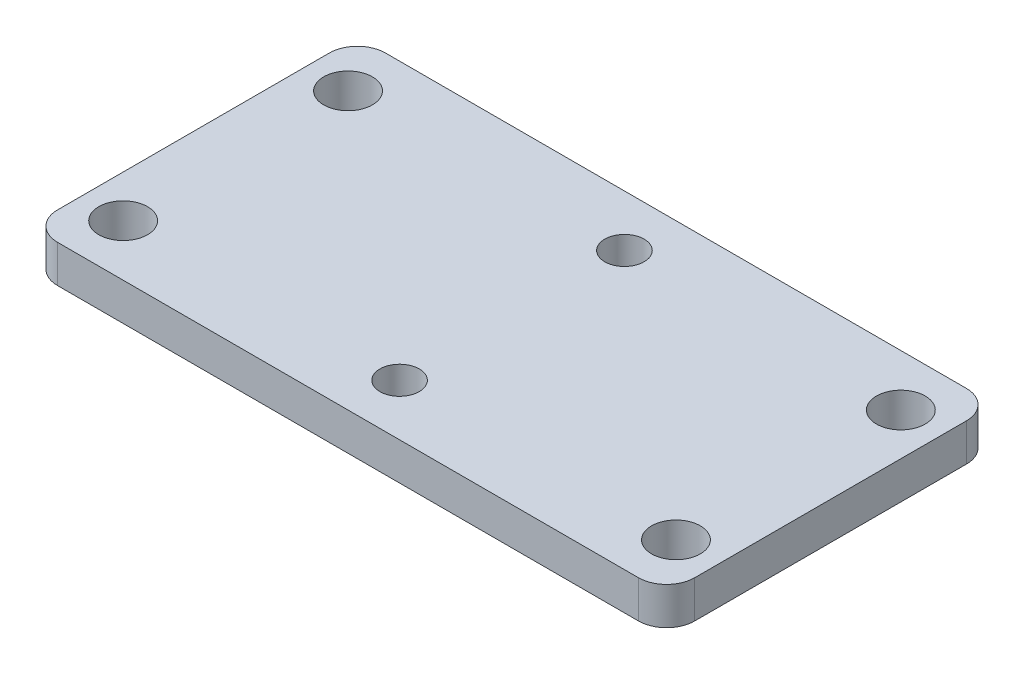
from build123d import *

# Parameters (mm, degrees)
SKETCH_1_W          = 68
SKETCH_1_H          = 35
EXTRUDE_1_DEPTH     = 4
SKETCH_2_R          = 2.6
SKETCH_2_R_2        = 2.1
CUT_EXTRUDE_1_DEPTH = 4
FILLET_1_R          = 3


with BuildPart() as part:
    # 草图1 → 凸台-拉伸1 (new body)
    with BuildSketch(Plane(origin=(0, 0, 0), x_dir=(1, 0, 0), z_dir=(0, 1, 0))):
        Rectangle(SKETCH_1_W, SKETCH_1_H)
    extrude(amount=EXTRUDE_1_DEPTH)

    # 草图2 → 切除-拉伸1 (cut)
    with BuildSketch(Plane(origin=(0, 4, 0), x_dir=(1, 0, 0), z_dir=(0, 1, 0))):
        with Locations(Location((-29.5, 12, 0), (0, 0, 270))):
            Circle(SKETCH_2_R)
        with Locations(Location((29.5, 12, 0), (0, 0, 90))):
            Circle(SKETCH_2_R)
        with Locations(Location((29.5, -12, 0), (0, 0, 270))):
            Circle(SKETCH_2_R)
        with Locations(Location((-29.5, -12, 0), (0, 0, 90))):
            Circle(SKETCH_2_R)
        with Locations(Location((0, 12, 0), (0, 0, 270))):
            Circle(SKETCH_2_R_2)
        with Locations(Location((0, -12, 0), (0, 0, 90))):
            Circle(SKETCH_2_R_2)
    extrude(amount=-CUT_EXTRUDE_1_DEPTH, mode=Mode.SUBTRACT)

    # 圆角1
    fillet_1_edges = [part.edges().sort_by_distance(p)[0] for p in [
        (34, 2, 17.5),
        (-34, 2, 17.5),
        (-34, 2, -17.5),
        (34, 2, -17.5),
    ]]
    fillet(fillet_1_edges, radius=FILLET_1_R)


solid = part.part
